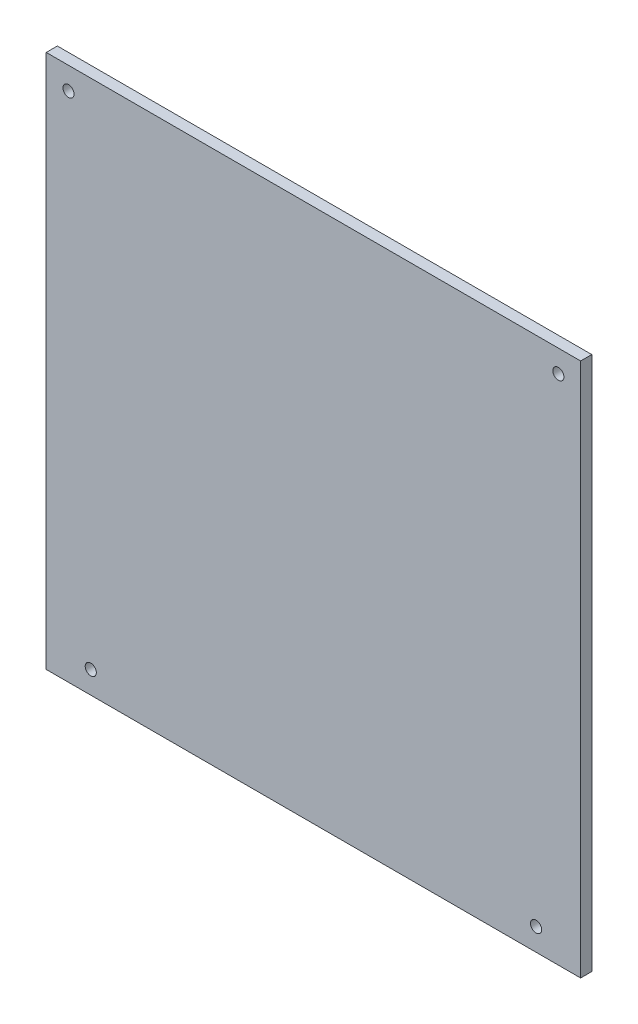
from build123d import *

# Parameters (mm, degrees)
SKETCH1_W           = 304.8
SKETCH1_H           = 304.8
SKETCH1_R           = 3.175
BOSS_EXTRUDE1_DEPTH = 6.35


with BuildPart() as part:
    # Sketch1 → Boss-Extrude1 (new body)
    with BuildSketch(Plane.XY):
        Rectangle(SKETCH1_W, SKETCH1_H)
        with Locations((139.7, 139.7)):
            Circle(SKETCH1_R, mode=Mode.SUBTRACT)
        with Locations((-139.7, 139.7)):
            Circle(SKETCH1_R, mode=Mode.SUBTRACT)
        with Locations((127, -139.7)):
            Circle(SKETCH1_R, mode=Mode.SUBTRACT)
        with Locations((-127, -139.7)):
            Circle(SKETCH1_R, mode=Mode.SUBTRACT)
    extrude(amount=BOSS_EXTRUDE1_DEPTH)


solid = part.part
